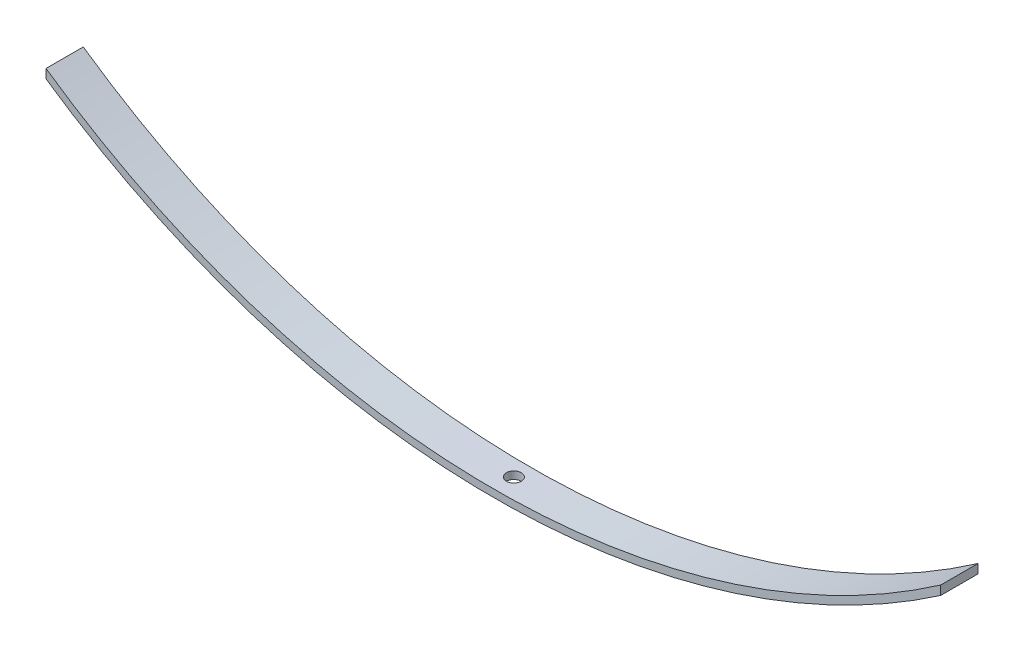
from build123d import *

# Parameters (mm, degrees)
BOSS_EXTRUDE1_DEPTH = 50
SKETCH3_R           = 10
CUT_EXTRUDE1_DEPTH  = 1220.057012613


with BuildPart() as part:
    # Sketch1 → Boss-Extrude1 (new body)
    with BuildSketch(Plane.XY):
        with BuildLine():
            Line((-600, -873.842090998), (-600, -861.684396981))
            ThreePointArc((-600, -861.684396981), (0, -1050), (600, -861.684396981))
            Line((600, -861.684396981), (600, -873.842090998))
            ThreePointArc((600, -873.842090998), (0, -1060), (-600, -873.842090998))
        make_face()
    extrude(amount=BOSS_EXTRUDE1_DEPTH)

    # Sketch3 → Cut-Extrude1 (cut, through all)
    with BuildSketch(Plane(origin=(0, 0, 0), x_dir=(1, 0, 0), z_dir=(0, 1, 0))):
        with Locations(Location((0, -22.5, 0), (0, 0, 270))):
            Circle(SKETCH3_R)
    extrude(amount=-CUT_EXTRUDE1_DEPTH, mode=Mode.SUBTRACT)


solid = part.part
